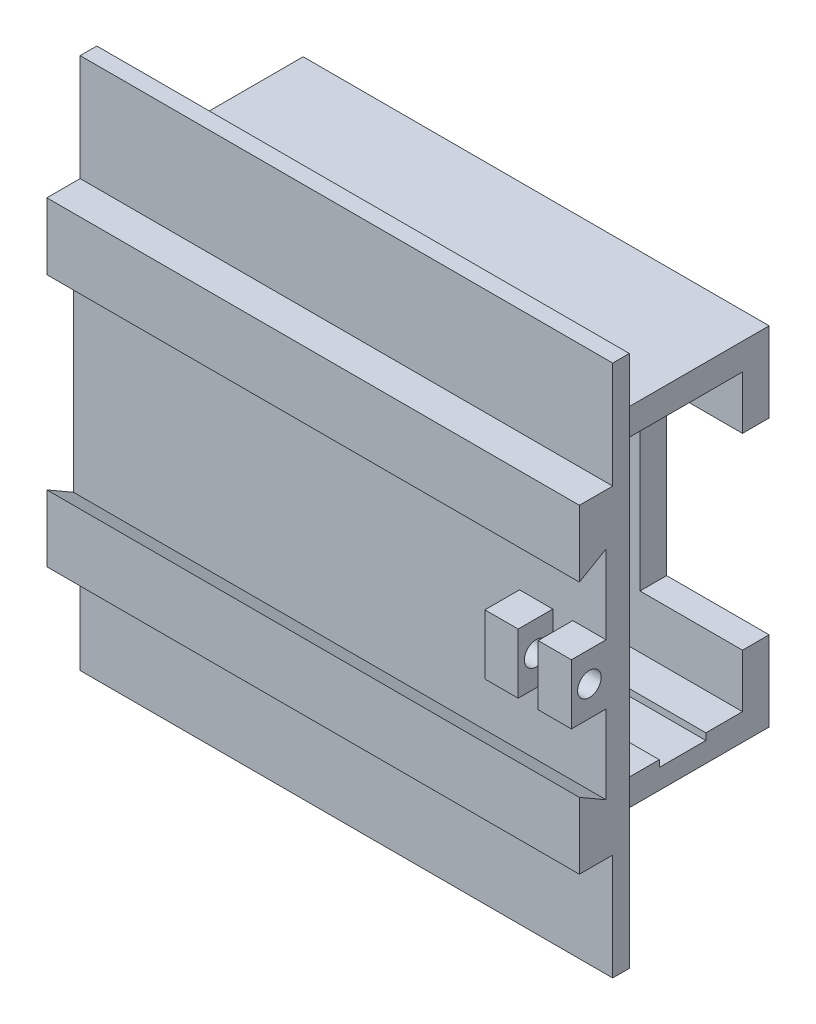
from build123d import *

# Parameters (mm, degrees)
SKETCH1_W                    = 101.6
SKETCH1_H                    = 101.6
EXTRUDE1_DEPTH               = 3.175
SKETCH2_W                    = 101.6
SKETCH2_H                    = 60.96
EXTRUDE2_DEPTH               = 6.35
EXTRUDE3_DEPTH               = 114.990901501
SKETCH4_W                    = 88.9
SKETCH4_H                    = 66.294
EXTRUDE4_DEPTH               = 35.56
SKETCH5_W                    = 27.305
SKETCH5_H                    = 56.134
EXTRUDE5_DEPTH               = 112.536082502
SKETCH6_W                    = 3.175
SKETCH6_H                    = 56.134
EXTRUDE6_DEPTH               = 12.7
SKETCH7_W                    = 8.89
SKETCH7_H                    = 1.27
EXTRUDE7_DEPTH               = 79.375
SKETCH8_W                    = 5.08
SKETCH8_H                    = 35.814
EXTRUDE8_DEPTH               = 19.558
F_5_16_CLEARANCE_HOLE1_D     = 8.4328
F_5_16_CLEARANCE_HOLE1_DEPTH = 12.954
F_5_16_CLEARANCE_HOLE1_TIP   = 2.533468714
EXTRUDE9_DEPTH               = 6.604
F_8_CLEARANCE_HOLE1_D        = 4.4958
LPATTERN1_COUNT              = 2
LPATTERN1_PITCH              = 10.16


with BuildPart() as part:
    # Sketch1 → Extrude1 (new body)
    with BuildSketch(Plane.XY):
        Rectangle(SKETCH1_W, SKETCH1_H)
    extrude(amount=EXTRUDE1_DEPTH)

    # Sketch2 → Extrude2 (add)
    with BuildSketch(Plane.XY.offset(3.175)):
        Rectangle(SKETCH2_W, SKETCH2_H)
    extrude(amount=EXTRUDE2_DEPTH)

    # Sketch3 → Extrude3 (cut, through all)
    with BuildSketch(Plane(origin=(50.8, 0, 0), x_dir=(0, 0, -1), z_dir=(1, 0, 0))):
        Polygon((-9.525, -17.78), (-4.445, -20.712939367), (-4.445, 20.712939367), (-9.525, 17.78), align=None)
    extrude(amount=-EXTRUDE3_DEPTH, mode=Mode.SUBTRACT)

    # Sketch4 → Extrude4 (add)
    with BuildSketch(Plane(origin=(0, 0, 0), x_dir=(-1, 0, 0), z_dir=(0, 0, -1))):
        with Locations((2.54, 0)):
            Rectangle(SKETCH4_W, SKETCH4_H)
    extrude(amount=EXTRUDE4_DEPTH)

    # Sketch5 → Extrude5 (cut, through all)
    with BuildSketch(Plane(origin=(41.91, 0, 0), x_dir=(0, 0, -1), z_dir=(1, 0, 0))):
        with Locations((16.8275, 0)):
            Rectangle(SKETCH5_W, SKETCH5_H)
    extrude(amount=-EXTRUDE5_DEPTH, mode=Mode.SUBTRACT)

    # Sketch6 → Extrude6 (add)
    with BuildSketch(Plane(origin=(0, 0, -3.175), x_dir=(-1, 0, 0), z_dir=(0, 0, -1))):
        with Locations((45.4025, 0)):
            Rectangle(SKETCH6_W, SKETCH6_H)
    extrude(amount=EXTRUDE6_DEPTH)

    # Sketch7 → Extrude7 (cut)
    with BuildSketch(Plane(origin=(41.91, 0, 0), x_dir=(0, 0, -1), z_dir=(1, 0, 0))):
        with Locations((19.05, -28.702)):
            Rectangle(SKETCH7_W, SKETCH7_H)
    extrude(amount=-EXTRUDE7_DEPTH, mode=Mode.SUBTRACT)

    # Sketch8 → Extrude8 (cut)
    with BuildSketch(Plane(origin=(41.91, 0, 0), x_dir=(0, 0, -1), z_dir=(1, 0, 0))):
        with Locations((33.02, 0)):
            Rectangle(SKETCH8_W, SKETCH8_H)
    extrude(amount=-EXTRUDE8_DEPTH, mode=Mode.SUBTRACT)

    # 5/16 Clearance Hole1
    with Locations(Plane(origin=(12.8016, -33.147, -20.066), x_dir=(-1, 0, 0), z_dir=(0, -1, 0))):
        with Locations((0, 0)):
            Hole(F_5_16_CLEARANCE_HOLE1_D / 2, depth=F_5_16_CLEARANCE_HOLE1_DEPTH)
            with Locations((0, 0, -(F_5_16_CLEARANCE_HOLE1_DEPTH + F_5_16_CLEARANCE_HOLE1_TIP / 2))):  # 118° drill point
                Cone(0, F_5_16_CLEARANCE_HOLE1_D / 2, F_5_16_CLEARANCE_HOLE1_TIP, mode=Mode.SUBTRACT)

    # Sketch11 → Extrude9 (add)
    with BuildSketch(Plane.XY.offset(4.445)):
        Polygon((50.8, 0), (50.8, -5.715), (44.45, -5.715), (44.45, 5.715), (50.8, 5.715), align=None)
    extrude9 = extrude(amount=EXTRUDE9_DEPTH)

    # #8 Clearance Hole1 (through all)
    with Locations(Plane(origin=(50.8, 0, 7.62), x_dir=(0, 0, 1), z_dir=(1, 0, 0))):
        with Locations((0, 0)):
            f_8_clearance_hole1 = Hole(F_8_CLEARANCE_HOLE1_D / 2)

    # LPattern1: Extrude9, #8 Clearance Hole1 ×2
    with Locations(*[(-i * LPATTERN1_PITCH, 0, 0) for i in range(1, LPATTERN1_COUNT)]):
        add(extrude9)
        add(f_8_clearance_hole1, mode=Mode.SUBTRACT)


solid = part.part
